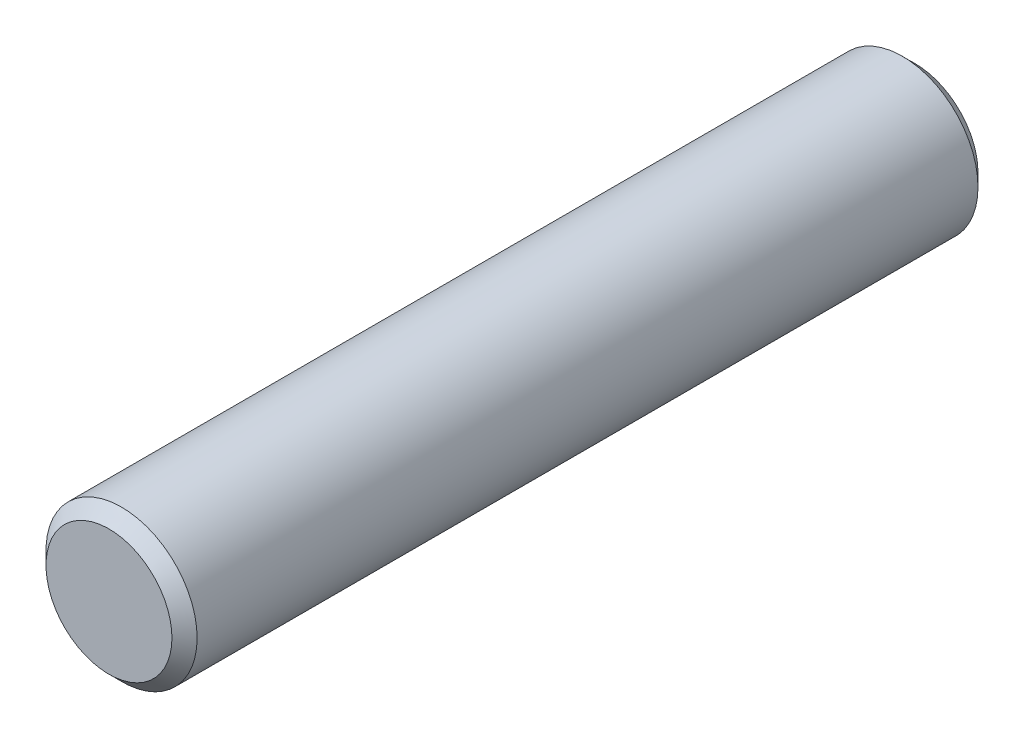
from build123d import *

# Parameters (mm, degrees)
SKETCH1_R           = 3
BOSS_EXTRUDE1_DEPTH = 16
CHAMFER1_SIZE       = 0.5


with BuildPart() as part:
    # Sketch1 → Boss-Extrude1 (new, symmetric)
    with BuildSketch(Plane.XY):
        Circle(SKETCH1_R)
    extrude(amount=BOSS_EXTRUDE1_DEPTH, both=True)

    # Chamfer1
    chamfer1_edges = [part.edges().sort_by_distance(p)[0] for p in [
        (-3, 0, -16),
        (-3, 0, 16),
    ]]
    chamfer(chamfer1_edges, length=CHAMFER1_SIZE)


solid = part.part
